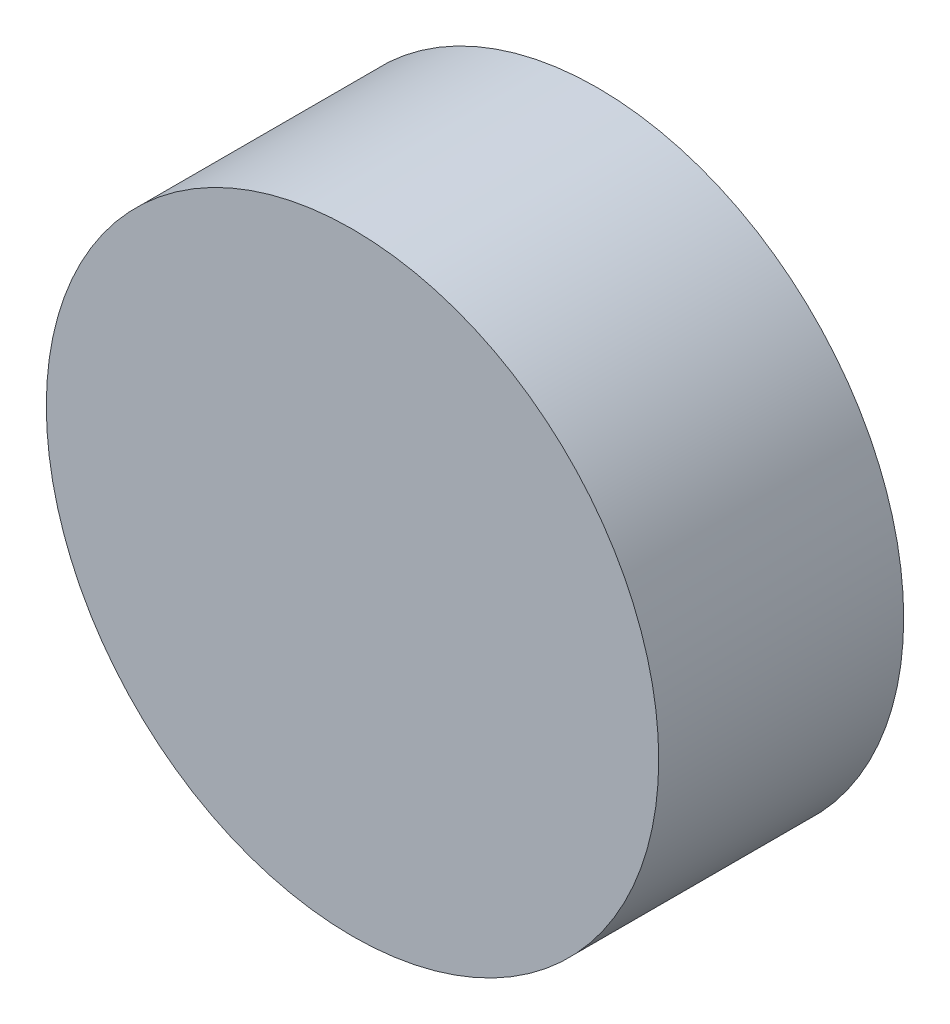
from build123d import *

# Parameters (mm, degrees)
SKIZZE1_R                       = 2.5
AUFSATZ_LINEAR_AUSTRAGEN1_DEPTH = 2


with BuildPart() as part:
    # Skizze1 → Aufsatz-Linear austragen1 (new body)
    with BuildSketch(Plane(origin=(0, 0, 0), x_dir=(0, 1, 0), z_dir=(0, 0, 1))):
        with Locations(Location((0, 0, 0), (0, 0, 270))):
            Circle(SKIZZE1_R)
    extrude(amount=AUFSATZ_LINEAR_AUSTRAGEN1_DEPTH)


solid = part.part
